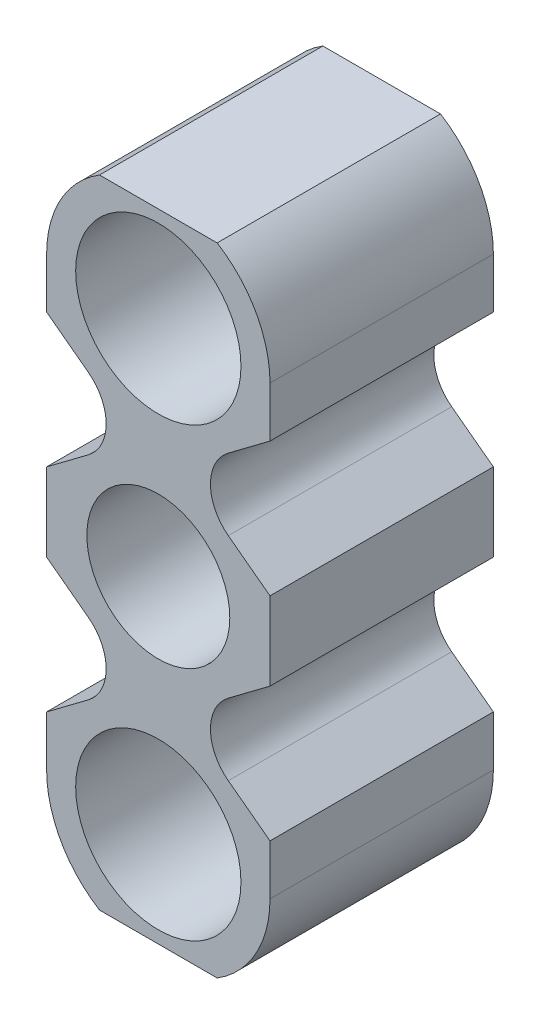
from build123d import *

# Parameters (mm, degrees)
ESQUISSE1_R             = 3.7
ESQUISSE1_R_2           = 3.2
BOSS_EXTRU_1_DEPTH      = 10
ENL_V_START             = -10
ENL_V_MAT_EXTRU_1_DEPTH = 29.708286934
SYM_TRIE2_START         = -10
SYM_TRIE2_COPY_1_DEPTH  = 29.708286934
CONG_1_R                = 2
ESQUISSE3_W             = 16.438795986
ESQUISSE3_H             = 1.5
ESQUISSE3_W_2           = 21.038627968
ENL_V_MAT_EXTRU_2_DEPTH = 19.708286934


with BuildPart() as part:
    # Esquisse1 → Boss.-Extru.1 (new body)
    with BuildSketch(Plane.XY):
        with BuildLine():
            ThreePointArc((5, 10), (0, 15), (-5, 10))
            Line((-5, 10), (-5, -10))
            ThreePointArc((-5, -10), (0, -15), (5, -10))
            Line((5, -10), (5, 10))
        make_face()
        with Locations((0, 10)):
            Circle(ESQUISSE1_R, mode=Mode.SUBTRACT)
        Circle(ESQUISSE1_R_2, mode=Mode.SUBTRACT)
        with Locations((0, -10)):
            Circle(ESQUISSE1_R, mode=Mode.SUBTRACT)
    extrude(amount=BOSS_EXTRU_1_DEPTH)

    # Esquisse2 → Enlèv. mat.-Extru.1 (cut)
    with BuildSketch(Plane.XY.offset(10).offset(ENL_V_START)):
        Polygon((52.761287706, 43.570965779), (5, 7.75), (1, 4.75), (5, 1.75), (52.761287706, -34.070965779), (172.164506969, -34.070965779), (172.164506969, 43.570965779), align=None)
    enl_v_mat_extru_1 = extrude(amount=ENL_V_MAT_EXTRU_1_DEPTH, mode=Mode.SUBTRACT)

    # Symétrie1: Enlèv. mat.-Extru.1 across plane
    add(enl_v_mat_extru_1.mirror(Plane(origin=(0, 0, 0), x_dir=(0, 0, 1), z_dir=(1, 0, 0))), mode=Mode.SUBTRACT)

    # Symétrie2: Enlèv. mat.-Extru.1 across plane
    add(enl_v_mat_extru_1.mirror(Plane.ZX), mode=Mode.SUBTRACT)

    # Symétrie2 copy 1 sketch → Symétrie2 copy 1 (cut)
    with BuildSketch(Plane(origin=(0, 0, 10), x_dir=(-1, 0, 0), z_dir=(0, 0, 1)).offset(SYM_TRIE2_START)):
        Polygon((52.761287706, 43.570965779), (5, 7.75), (1, 4.75), (5, 1.75), (52.761287706, -34.070965779), (172.164506969, -34.070965779), (172.164506969, 43.570965779), align=None)
    extrude(amount=SYM_TRIE2_COPY_1_DEPTH, mode=Mode.SUBTRACT)

    # Congé1
    cong_1_edges = [part.edges().sort_by_distance(p)[0] for p in [
        (1, 4.75, 5),
        (-1, 4.75, 5),
        (-1, -4.75, 5),
        (1, -4.75, 5),
    ]]
    fillet(cong_1_edges, radius=CONG_1_R)

    # Esquisse3 → Enlèv. mat.-Extru.2 (cut, through all)
    with BuildSketch(Plane(origin=(0, 0, 0), x_dir=(-1, 0, 0), z_dir=(0, 0, -1))):
        with Locations((0, 15)):
            Rectangle(ESQUISSE3_W, ESQUISSE3_H)
        with Locations((0, -15)):
            Rectangle(ESQUISSE3_W_2, ESQUISSE3_H)
    extrude(amount=-ENL_V_MAT_EXTRU_2_DEPTH, mode=Mode.SUBTRACT)


solid = part.part
